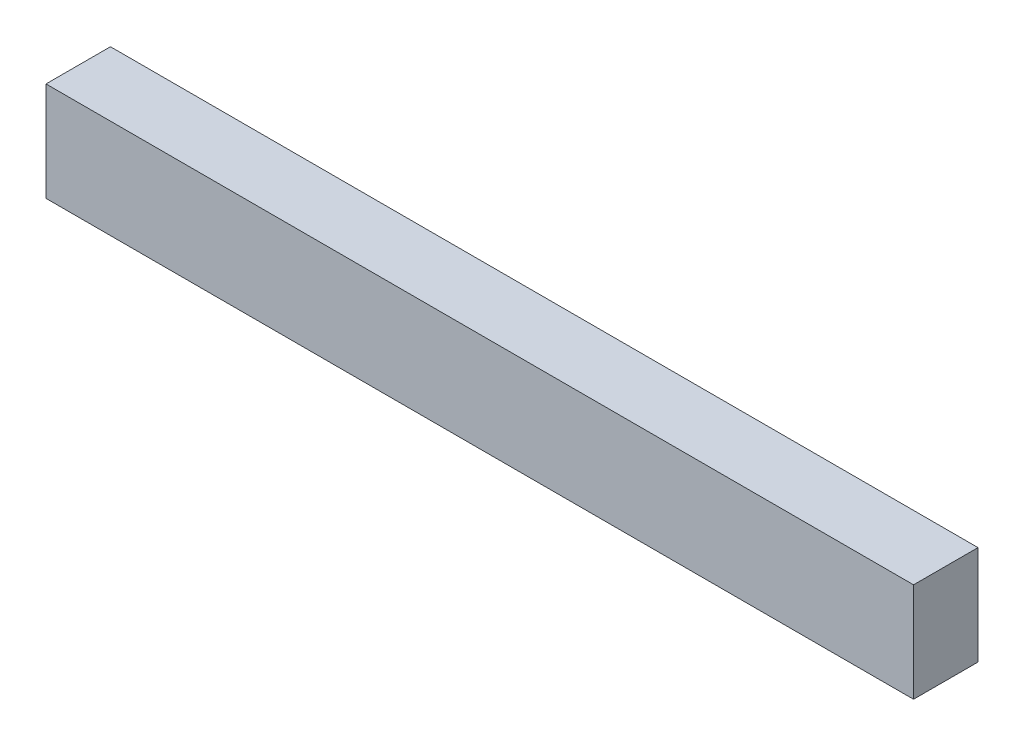
from build123d import *

# Parameters (mm, degrees)
SZKIC1_W                    = 35
SZKIC1_H                    = 4
DODANIE_WYCI_GNI_CIE1_DEPTH = 2.6


with BuildPart() as part:
    # Szkic1 → Dodanie-wyciągnięcie1 (new body)
    with BuildSketch(Plane.XY):
        Rectangle(SZKIC1_W, SZKIC1_H)
    extrude(amount=DODANIE_WYCI_GNI_CIE1_DEPTH)


solid = part.part
